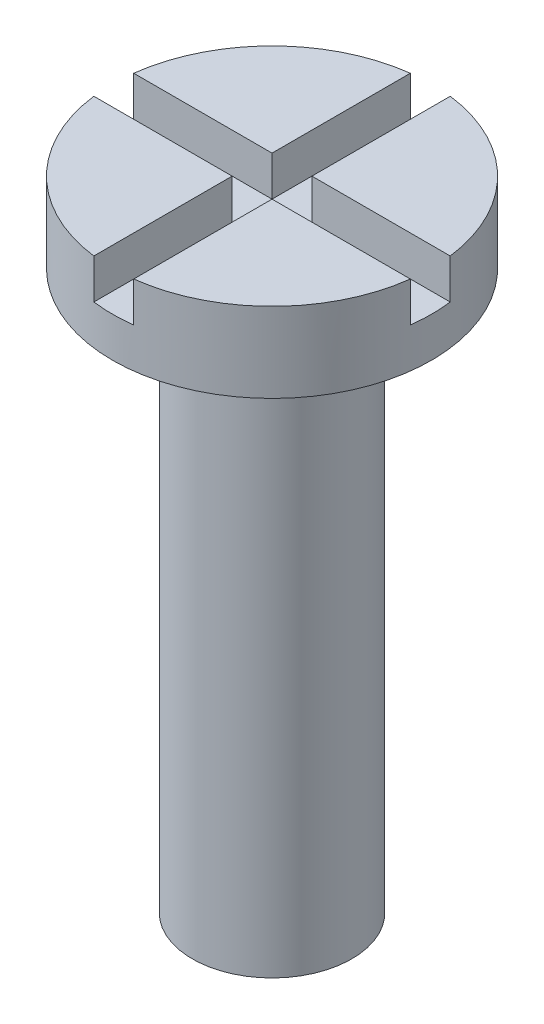
from build123d import *

# Parameters (mm, degrees)
SKETCH1_R           = 1
BOSS_EXTRUDE1_DEPTH = 7
SKETCH2_R           = 2
BOSS_EXTRUDE2_DEPTH = 1
CUT_EXTRUDE1_DEPTH  = 0.5


with BuildPart() as part:
    # Sketch1 → Boss-Extrude1 (new body)
    with BuildSketch(Plane(origin=(0, 0, 0), x_dir=(1, 0, 0), z_dir=(0, 1, 0))):
        with Locations(Location((0, 0, 0), (0, 0, 90))):
            Circle(SKETCH1_R)
    extrude(amount=BOSS_EXTRUDE1_DEPTH)

    # Sketch2 → Boss-Extrude2 (add)
    with BuildSketch(Plane(origin=(0, 7, 0), x_dir=(1, 0, 0), z_dir=(0, 1, 0))):
        with Locations(Location((0, 0, 0), (0, 0, 270))):
            Circle(SKETCH2_R)
    extrude(amount=BOSS_EXTRUDE2_DEPTH)

    # Sketch3 → Cut-Extrude1 (cut)
    with BuildSketch(Plane(origin=(0, 8, 0), x_dir=(1, 0, 0), z_dir=(0, 1, 0))):
        Polygon((-2, 0.25), (-2, -0.25), (-0.25, -0.25), (-0.25, -2), (0.25, -2), (0.25, -0.25), (2, -0.25), (2, 0.25), (0.25, 0.25), (0.25, 2), (-0.25, 2), (-0.25, 0.25), align=None)
    extrude(amount=-CUT_EXTRUDE1_DEPTH, mode=Mode.SUBTRACT)


solid = part.part
